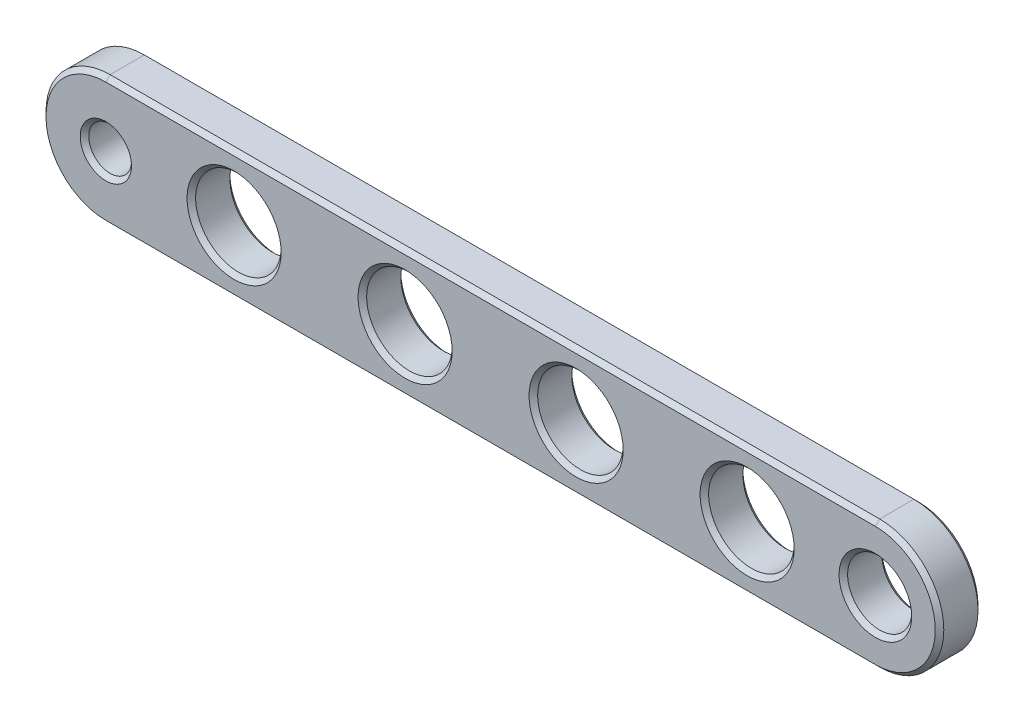
from build123d import *

# Parameters (mm, degrees)
SKETCH1_R           = 1
SKETCH1_R_2         = 2
SKETCH1_R_3         = 1.5
BOSS_EXTRUDE1_DEPTH = 2
CHAMFER1_SIZE       = 0.2


with BuildPart() as part:
    # Sketch1 → Boss-Extrude1 (new body)
    with BuildSketch(Plane.XY):
        with BuildLine():
            Line((-18, 3), (18, 3))
            ThreePointArc((18, 3), (21, 0), (18, -3))
            Line((18, -3), (-18, -3))
            ThreePointArc((-18, -3), (-21, 0), (-18, 3))
        make_face()
        with Locations((-18, 0)):
            Circle(SKETCH1_R, mode=Mode.SUBTRACT)
        with Locations((-12, 0)):
            Circle(SKETCH1_R_2, mode=Mode.SUBTRACT)
        with Locations((-4, 0)):
            Circle(SKETCH1_R_2, mode=Mode.SUBTRACT)
        with Locations((18, 0)):
            Circle(SKETCH1_R_3, mode=Mode.SUBTRACT)
        with Locations((12, 0)):
            Circle(SKETCH1_R_2, mode=Mode.SUBTRACT)
        with Locations((4, 0)):
            Circle(SKETCH1_R_2, mode=Mode.SUBTRACT)
    extrude(amount=BOSS_EXTRUDE1_DEPTH)

    # Chamfer1
    chamfer1_edges = [part.edges().sort_by_distance(p)[0] for p in [
        (-19, 0, 0),
        (-19, 0, 2),
        (21, 0, 2),
        (-14, 0, 0),
        (-14, 0, 2),
        (0, 3, 2),
        (-6, 0, 0),
        (-6, 0, 2),
        (16.5, 0, 0),
        (16.5, 0, 2),
        (10, 0, 0),
        (10, 0, 2),
        (2, 0, 0),
        (2, 0, 2),
        (-21, 0, 2),
        (0, 3, 0),
        (21, 0, 0),
        (0, -3, 0),
        (-21, 0, 0),
        (0, -3, 2),
    ]]
    chamfer(chamfer1_edges, length=CHAMFER1_SIZE)


solid = part.part
